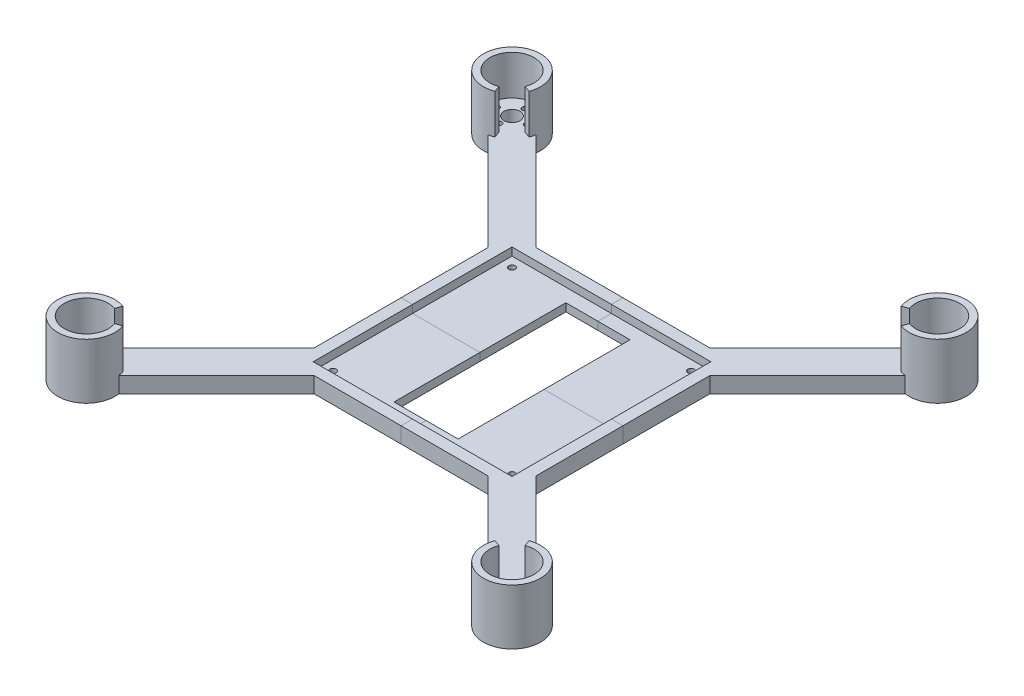
from build123d import *

# Parameters (mm, degrees)
SKETCH_1_R                       = 2
SKETCH_1_R_2                     = 1.65
SKETCH_1_R_3                     = 5.1
SKETCH_1_W                       = 40.5
SKETCH_1_H                       = 108.5
EXTRUDE_1_DEPTH                  = 10
EXTRUDE_START                    = 25
EXTRUDE_2_DEPTH                  = 25
PATTERN_CIRCULAR_1_COUNT         = 4
SKETCH_4_W                       = 125.5
SKETCH_4_H                       = 125.5
CUT_EXTRUDE_1_DEPTH              = 5
SPLIT_BODIES_1_SURFACE_1_1_BACK  = 433.331
SPLIT_BODIES_1_SURFACE_1_1_DEPTH = 866.662
SPLIT_BODIES_1_SURFACE_1_2_BACK  = 433.331
SPLIT_BODIES_1_SURFACE_1_2_DEPTH = 866.662
SPLIT_BODIES_1_SURFACE_2_3_BACK  = 433.331
SPLIT_BODIES_1_SURFACE_2_3_DEPTH = 866.662
SPLIT_BODIES_1_SURFACE_2_4_BACK  = 433.331
SPLIT_BODIES_1_SURFACE_2_4_DEPTH = 866.662
SPLIT_BODIES_1_SURFACE_2_5_BACK  = 433.331
SPLIT_BODIES_1_SURFACE_2_5_DEPTH = 866.662
SPLIT_BODIES_1_SURFACE_2_6_BACK  = 433.331
SPLIT_BODIES_1_SURFACE_2_6_DEPTH = 866.662


with BuildPart() as part:
    # 스케치1 → 보스-돌출1 (new body)
    with BuildSketch(Plane(origin=(0, 0, 0), x_dir=(1, 0, 0), z_dir=(0, 1, 0))):
        with BuildLine():
            Line((55, 70), (116.566806525, 131.566806525))
            ThreePointArc((116.566806525, 131.566806525), (147.078210487, 147.078210487), (131.566806525, 116.566806525))
            Line((131.566806525, 116.566806525), (70, 55))
            Line((70, 55), (70, -55))
            Line((70, -55), (131.566806525, -116.566806525))
            ThreePointArc((131.566806525, -116.566806525), (147.078210487, -147.078210487), (116.566806525, -131.566806525))
            Line((116.566806525, -131.566806525), (55, -70))
            Line((55, -70), (-55, -70))
            Line((-55, -70), (-116.566806525, -131.566806525))
            ThreePointArc((-116.566806525, -131.566806525), (-147.078210487, -147.078210487), (-131.566806525, -116.566806525))
            Line((-131.566806525, -116.566806525), (-70, -55))
            Line((-70, -55), (-70, 55))
            Line((-70, 55), (-131.566806525, 116.566806525))
            ThreePointArc((-131.566806525, 116.566806525), (-147.078210487, 147.078210487), (-116.566806525, 131.566806525))
            Line((-116.566806525, 131.566806525), (-55, 70))
            Line((-55, 70), (55, 70))
        make_face()
        with Locations((-56.5, -56.5)):
            Circle(SKETCH_1_R, mode=Mode.SUBTRACT)
        with Locations((56.5, -56.5)):
            Circle(SKETCH_1_R, mode=Mode.SUBTRACT)
        with Locations((56.5, 56.5)):
            Circle(SKETCH_1_R, mode=Mode.SUBTRACT)
        with Locations((-56.5, 56.5)):
            Circle(SKETCH_1_R, mode=Mode.SUBTRACT)
        with Locations((134.350288425, 124.850288425)):
            Circle(SKETCH_1_R_2, mode=Mode.SUBTRACT)
        with Locations((126.350288425, 134.350288425)):
            Circle(SKETCH_1_R_2, mode=Mode.SUBTRACT)
        with Locations((142.350288425, 134.350288425)):
            Circle(SKETCH_1_R_2, mode=Mode.SUBTRACT)
        with Locations((134.350288425, 143.850288425)):
            Circle(SKETCH_1_R_2, mode=Mode.SUBTRACT)
        with Locations((134.350288425, 134.350288425)):
            Circle(SKETCH_1_R_3, mode=Mode.SUBTRACT)
        with Locations((124.850288425, -134.350288425)):
            Circle(SKETCH_1_R_2, mode=Mode.SUBTRACT)
        with Locations((134.350288425, -126.350288425)):
            Circle(SKETCH_1_R_2, mode=Mode.SUBTRACT)
        with Locations((134.350288425, -142.350288425)):
            Circle(SKETCH_1_R_2, mode=Mode.SUBTRACT)
        with Locations((143.850288425, -134.350288425)):
            Circle(SKETCH_1_R_2, mode=Mode.SUBTRACT)
        with Locations((134.350288425, -134.350288425)):
            Circle(SKETCH_1_R_3, mode=Mode.SUBTRACT)
        with Locations((-134.350288425, -124.850288425)):
            Circle(SKETCH_1_R_2, mode=Mode.SUBTRACT)
        with Locations((-126.350288425, -134.350288425)):
            Circle(SKETCH_1_R_2, mode=Mode.SUBTRACT)
        with Locations((-142.350288425, -134.350288425)):
            Circle(SKETCH_1_R_2, mode=Mode.SUBTRACT)
        with Locations((-134.350288425, -143.850288425)):
            Circle(SKETCH_1_R_2, mode=Mode.SUBTRACT)
        with Locations((-134.350288425, -134.350288425)):
            Circle(SKETCH_1_R_3, mode=Mode.SUBTRACT)
        with Locations((-124.850288425, 134.350288425)):
            Circle(SKETCH_1_R_2, mode=Mode.SUBTRACT)
        with Locations((-134.350288425, 126.350288425)):
            Circle(SKETCH_1_R_2, mode=Mode.SUBTRACT)
        with Locations((-134.350288425, 142.350288425)):
            Circle(SKETCH_1_R_2, mode=Mode.SUBTRACT)
        with Locations((-143.850288425, 134.350288425)):
            Circle(SKETCH_1_R_2, mode=Mode.SUBTRACT)
        with Locations((-134.350288425, 134.350288425)):
            Circle(SKETCH_1_R_3, mode=Mode.SUBTRACT)
        Rectangle(SKETCH_1_W, SKETCH_1_H, mode=Mode.SUBTRACT)
    extrude(amount=-EXTRUDE_1_DEPTH)

    # 스케치3 → 보스-돌출2 (add)
    with BuildSketch(Plane(origin=(0, 0, 0), x_dir=(1, 0, 0), z_dir=(0, 1, 0)).offset(EXTRUDE_START)):
        with BuildLine():
            Line((117.435821251, 128.193925846), (121.288560997, 129.596208433))
            ThreePointArc((121.288560997, 129.596208433), (131.936578756, 148.039116192), (148.250288425, 134.350288425))
            ThreePointArc((148.250288425, 134.350288425), (142.323000891, 122.96407501), (129.596208433, 121.288560997))
            Line((129.596208433, 121.288560997), (128.193925846, 117.435821251))
            ThreePointArc((128.193925846, 117.435821251), (129.859297278, 116.919539775), (131.566806525, 116.566806525))
            ThreePointArc((131.566806525, 116.566806525), (146.052795118, 120.673617153), (152.350288425, 134.350288425))
            ThreePointArc((152.350288425, 134.350288425), (132.954343264, 152.296077266), (116.566806525, 131.566806525))
            ThreePointArc((116.566806525, 131.566806525), (116.919539775, 129.859297278), (117.435821251, 128.193925846))
        make_face()
    extrude_2 = extrude(amount=-EXTRUDE_2_DEPTH)

    # 원형 패턴1: 보스-돌출2 ×4 about axis
    pattern_circular_1_axis = Axis((0, 26.25, 0), (0, -1, 0))
    for i in range(1, PATTERN_CIRCULAR_1_COUNT):
        add(extrude_2.rotate(pattern_circular_1_axis, i * 360 / PATTERN_CIRCULAR_1_COUNT))

    # 스케치4 → 컷-돌출1 (cut)
    with BuildSketch(Plane(origin=(0, 0, 0), x_dir=(1, 0, 0), z_dir=(0, 1, 0))):
        Rectangle(SKETCH_4_W, SKETCH_4_H)
    extrude(amount=-CUT_EXTRUDE_1_DEPTH, mode=Mode.SUBTRACT)


with BuildPart() as body_2:
    # Split Bodies 1: the piece behind the surface
    add(part.part)
    # Split Bodies 1 surface 1: a surface, the sketch's curves swept straight by 866.662 mm
    with BuildLine(Plane(origin=(0, 0, 0), x_dir=(1, 0, 0), z_dir=(0, 1, 0)).offset(-SPLIT_BODIES_1_SURFACE_1_1_BACK), mode=Mode.PRIVATE) as split_bodies_1_surface_1_1_path:
        Line((0, 249.205352091), (0, -249.205352091))
    split_bodies_1_surface_1_1 = Shell.extrude(split_bodies_1_surface_1_1_path.wire(), (0 * SPLIT_BODIES_1_SURFACE_1_1_DEPTH, 1 * SPLIT_BODIES_1_SURFACE_1_1_DEPTH, 0 * SPLIT_BODIES_1_SURFACE_1_1_DEPTH))
    split(bisect_by=split_bodies_1_surface_1_1, keep=Keep.BOTTOM)


with BuildPart() as part_1:
    add(part.part)

    # Split Bodies 1: split by a surface, the side it looks to stays
    # Split Bodies 1 surface 1: a surface, the sketch's curves swept straight by 866.662 mm
    with BuildLine(Plane(origin=(0, 0, 0), x_dir=(1, 0, 0), z_dir=(0, 1, 0)).offset(-SPLIT_BODIES_1_SURFACE_1_2_BACK), mode=Mode.PRIVATE) as split_bodies_1_surface_1_2_path:
        Line((0, 249.205352091), (0, -249.205352091))
    split_bodies_1_surface_1_2 = Shell.extrude(split_bodies_1_surface_1_2_path.wire(), (0 * SPLIT_BODIES_1_SURFACE_1_2_DEPTH, 1 * SPLIT_BODIES_1_SURFACE_1_2_DEPTH, 0 * SPLIT_BODIES_1_SURFACE_1_2_DEPTH))
    split(bisect_by=split_bodies_1_surface_1_2, keep=Keep.TOP)


with BuildPart() as body_3:
    # Split Bodies 1 2: the piece behind the surface
    add(part_1.part)
    # Split Bodies 1 surface 2: a surface, the sketch's curves swept straight by 866.662 mm
    with BuildLine(Plane(origin=(0, 0, 0), x_dir=(1, 0, 0), z_dir=(0, 1, 0)).offset(-SPLIT_BODIES_1_SURFACE_2_3_BACK), mode=Mode.PRIVATE) as split_bodies_1_surface_2_3_path:
        Line((-210.82792205, 0), (210.82792205, 0))
    split_bodies_1_surface_2_3 = Shell.extrude(split_bodies_1_surface_2_3_path.wire(), (0 * SPLIT_BODIES_1_SURFACE_2_3_DEPTH, 1 * SPLIT_BODIES_1_SURFACE_2_3_DEPTH, 0 * SPLIT_BODIES_1_SURFACE_2_3_DEPTH))
    split(bisect_by=split_bodies_1_surface_2_3, keep=Keep.BOTTOM)


with BuildPart() as part_2:
    add(part_1.part)

    # Split Bodies 1 2: split by a surface, the side it looks to stays
    # Split Bodies 1 surface 2: a surface, the sketch's curves swept straight by 866.662 mm
    with BuildLine(Plane(origin=(0, 0, 0), x_dir=(1, 0, 0), z_dir=(0, 1, 0)).offset(-SPLIT_BODIES_1_SURFACE_2_4_BACK), mode=Mode.PRIVATE) as split_bodies_1_surface_2_4_path:
        Line((-210.82792205, 0), (210.82792205, 0))
    split_bodies_1_surface_2_4 = Shell.extrude(split_bodies_1_surface_2_4_path.wire(), (0 * SPLIT_BODIES_1_SURFACE_2_4_DEPTH, 1 * SPLIT_BODIES_1_SURFACE_2_4_DEPTH, 0 * SPLIT_BODIES_1_SURFACE_2_4_DEPTH))
    split(bisect_by=split_bodies_1_surface_2_4, keep=Keep.TOP)


with BuildPart() as body_4:
    # Split Bodies 1 2 body 2: the piece behind the surface
    add(body_2.part)
    # Split Bodies 1 surface 2: a surface, the sketch's curves swept straight by 866.662 mm
    with BuildLine(Plane(origin=(0, 0, 0), x_dir=(1, 0, 0), z_dir=(0, 1, 0)).offset(-SPLIT_BODIES_1_SURFACE_2_5_BACK), mode=Mode.PRIVATE) as split_bodies_1_surface_2_5_path:
        Line((-210.82792205, 0), (210.82792205, 0))
    split_bodies_1_surface_2_5 = Shell.extrude(split_bodies_1_surface_2_5_path.wire(), (0 * SPLIT_BODIES_1_SURFACE_2_5_DEPTH, 1 * SPLIT_BODIES_1_SURFACE_2_5_DEPTH, 0 * SPLIT_BODIES_1_SURFACE_2_5_DEPTH))
    split(bisect_by=split_bodies_1_surface_2_5, keep=Keep.BOTTOM)


with BuildPart() as body_2_1:
    add(body_2.part)

    # Split Bodies 1 2 body 2: split by a surface, the side it looks to stays
    # Split Bodies 1 surface 2: a surface, the sketch's curves swept straight by 866.662 mm
    with BuildLine(Plane(origin=(0, 0, 0), x_dir=(1, 0, 0), z_dir=(0, 1, 0)).offset(-SPLIT_BODIES_1_SURFACE_2_6_BACK), mode=Mode.PRIVATE) as split_bodies_1_surface_2_6_path:
        Line((-210.82792205, 0), (210.82792205, 0))
    split_bodies_1_surface_2_6 = Shell.extrude(split_bodies_1_surface_2_6_path.wire(), (0 * SPLIT_BODIES_1_SURFACE_2_6_DEPTH, 1 * SPLIT_BODIES_1_SURFACE_2_6_DEPTH, 0 * SPLIT_BODIES_1_SURFACE_2_6_DEPTH))
    split(bisect_by=split_bodies_1_surface_2_6, keep=Keep.TOP)


solid = Compound([body_3.part, part_2.part, body_4.part, body_2_1.part])
